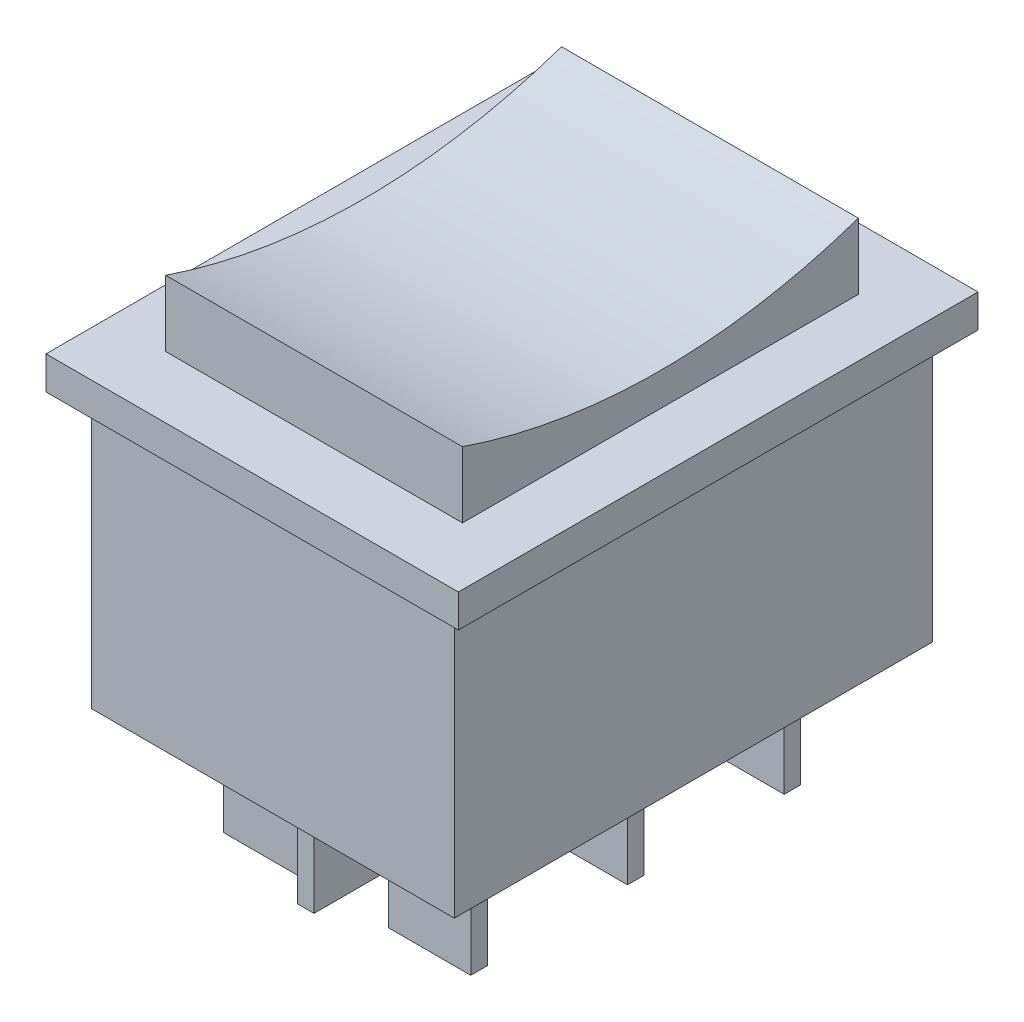
from build123d import *

# Parameters (mm, degrees)
SKIZZE1_W                       = 25
SKIZZE1_H                       = 31.5
AUFSATZ_LINEAR_AUSTRAGEN1_DEPTH = 2
SKIZZE2_W                       = 22
SKIZZE2_H                       = 29
AUFSATZ_LINEAR_AUSTRAGEN2_DEPTH = 16.5
SKIZZE3_W                       = 1
SKIZZE3_H                       = 25
AUFSATZ_LINEAR_AUSTRAGEN3_DEPTH = 6
SKIZZE4_W                       = 5
SKIZZE4_H                       = 1
AUFSATZ_LINEAR_AUSTRAGEN4_DEPTH = 7
SKIZZE5_W                       = 18
SKIZZE5_H                       = 24
AUFSATZ_LINEAR_AUSTRAGEN5_DEPTH = 4
SKIZZE6_R                       = 37
SCHNITT_LINEAR_AUSTRAGEN1_DEPTH = 36.532555495


with BuildPart() as part:
    # Skizze1 → Aufsatz-Linear austragen1 (new body)
    with BuildSketch(Plane(origin=(0, 0, 0), x_dir=(1, 0, 0), z_dir=(0, 1, 0))):
        Rectangle(SKIZZE1_W, SKIZZE1_H)
    extrude(amount=AUFSATZ_LINEAR_AUSTRAGEN1_DEPTH)

    # Skizze2 → Aufsatz-Linear austragen2 (add)
    with BuildSketch(Plane.XZ):
        Rectangle(SKIZZE2_W, SKIZZE2_H)
    extrude(amount=AUFSATZ_LINEAR_AUSTRAGEN2_DEPTH)

    # Skizze3 → Aufsatz-Linear austragen3 (add)
    with BuildSketch(Plane.XZ.offset(16.5)):
        Rectangle(SKIZZE3_W, SKIZZE3_H)
    extrude(amount=AUFSATZ_LINEAR_AUSTRAGEN3_DEPTH)

    # Skizze4 → Aufsatz-Linear austragen4 (add)
    with BuildSketch(Plane.XZ.offset(16.5)):
        with Locations((-5, 9.5)):
            Rectangle(SKIZZE4_W, SKIZZE4_H)
        with Locations((-5, 0)):
            Rectangle(SKIZZE4_W, SKIZZE4_H)
        with Locations((-5, -9.5)):
            Rectangle(SKIZZE4_W, SKIZZE4_H)
        with Locations((5, -9.5)):
            Rectangle(SKIZZE4_W, SKIZZE4_H)
        with Locations((5, 0)):
            Rectangle(SKIZZE4_W, SKIZZE4_H)
        with Locations((5, 9.5)):
            Rectangle(SKIZZE4_W, SKIZZE4_H)
    extrude(amount=AUFSATZ_LINEAR_AUSTRAGEN4_DEPTH)

    # Skizze5 → Aufsatz-Linear austragen5 (add)
    with BuildSketch(Plane(origin=(0, 2, 0), x_dir=(1, 0, 0), z_dir=(0, 1, 0))):
        Rectangle(SKIZZE5_W, SKIZZE5_H)
    extrude(amount=AUFSATZ_LINEAR_AUSTRAGEN5_DEPTH)

    # Skizze6 → Schnitt-Linear austragen1 (cut, through all)
    with BuildSketch(Plane.ZY.offset(9)):
        with Locations((0, 41)):
            Circle(SKIZZE6_R)
    extrude(amount=-SCHNITT_LINEAR_AUSTRAGEN1_DEPTH, mode=Mode.SUBTRACT)


solid = part.part
